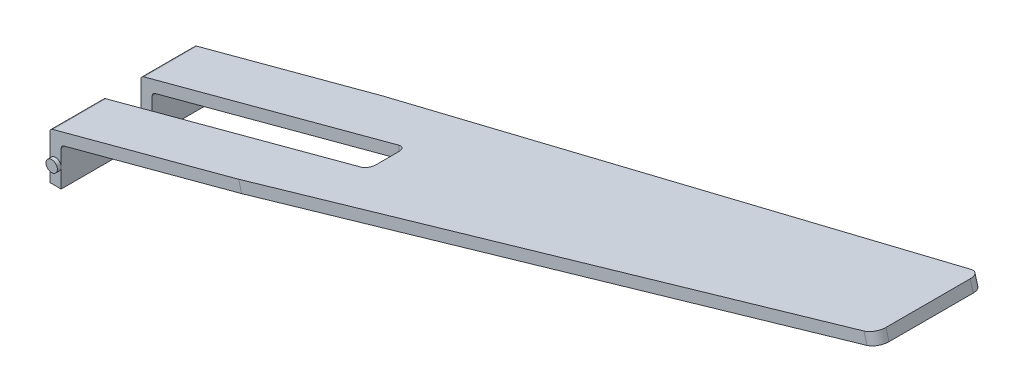
from build123d import *

# Parameters (mm, degrees)
PROFILE_EXTRUDE_DEPTH   = 3.8
CHAMFER_TOP_SIZE        = 0.5
CHAMFER_TOP_SIZE2       = 16.846754467
PINS_EXTRUDE_DEPTH      = 0.1
PINS_EXTRUDE_DEPTH_BACK = 3.9
SKETCH3_R               = 0.15
SLOT_SKETCH_W           = 7
SLOT_SKETCH_H           = 1
SLOT_CUT_DEPTH          = 10
FILLET1_R               = 0.1
FILLET2_R               = 0.3
FILLET3_R               = 0.2


with BuildPart() as part:
    # Profile Sketch → Profile Extrude (new body)
    with BuildSketch(Plane.XY):
        Polygon((0, 0), (0, 1.230198096), (21.250368178, 6.924217089), (21.328013892, 6.634439341), (0.3, 1), (0.3, 0), align=None)
    extrude(amount=PROFILE_EXTRUDE_DEPTH)

    # Chamfer Top
    chamfer_top_edges = [part.edges().sort_by_distance(p)[0] for p in [
        (21.289191035, 6.779328215, 3.8),
        (21.289191035, 6.779328215, 0),
    ]]
    chamfer_top_side = [part.faces().sort_by_distance(p)[0] for p in [
        (21.289191035, 6.779328215, 1.9),
    ]]
    chamfer(chamfer_top_edges, length=CHAMFER_TOP_SIZE, length2=CHAMFER_TOP_SIZE2, reference=chamfer_top_side[0])

    # Sketch3 → Pins Extrude (add, two sides: drawn at the far end of the back side and taken through both)
    with BuildSketch(Plane.XY.offset(3.8).offset(-PINS_EXTRUDE_DEPTH_BACK)):
        with Locations((0.15, 0.5)):
            Circle(SKETCH3_R)
    extrude(amount=PINS_EXTRUDE_DEPTH + PINS_EXTRUDE_DEPTH_BACK)

    # Slot Sketch → Slot Cut (cut)
    with BuildSketch(Plane.XZ):
        with Locations((3.5, 1.9)):
            Rectangle(SLOT_SKETCH_W, SLOT_SKETCH_H)
    extrude(amount=-SLOT_CUT_DEPTH, mode=Mode.SUBTRACT)

    # Fillet1
    fillet1_edges = [part.edges().sort_by_distance(p)[0] for p in [
        (0, 1.230198096, 3.1),
        (0.3, 1, 3.1),
        (0, 1.230198096, 0.7),
        (0.3, 1, 0.7),
    ]]
    fillet(fillet1_edges, radius=FILLET1_R)

    # Fillet2
    fillet2_edges = [part.edges().sort_by_distance(p)[0] for p in [
        (21.289191035, 6.779328215, 0.5),
        (21.289191035, 6.779328215, 3.3),
    ]]
    fillet(fillet2_edges, radius=FILLET2_R)

    # Fillet3
    fillet3_edges = [part.edges().sort_by_distance(p)[0] for p in [
        (7, 2.950551016, 2.4),
        (7, 2.950551016, 1.4),
    ]]
    fillet(fillet3_edges, radius=FILLET3_R)


solid = part.part
